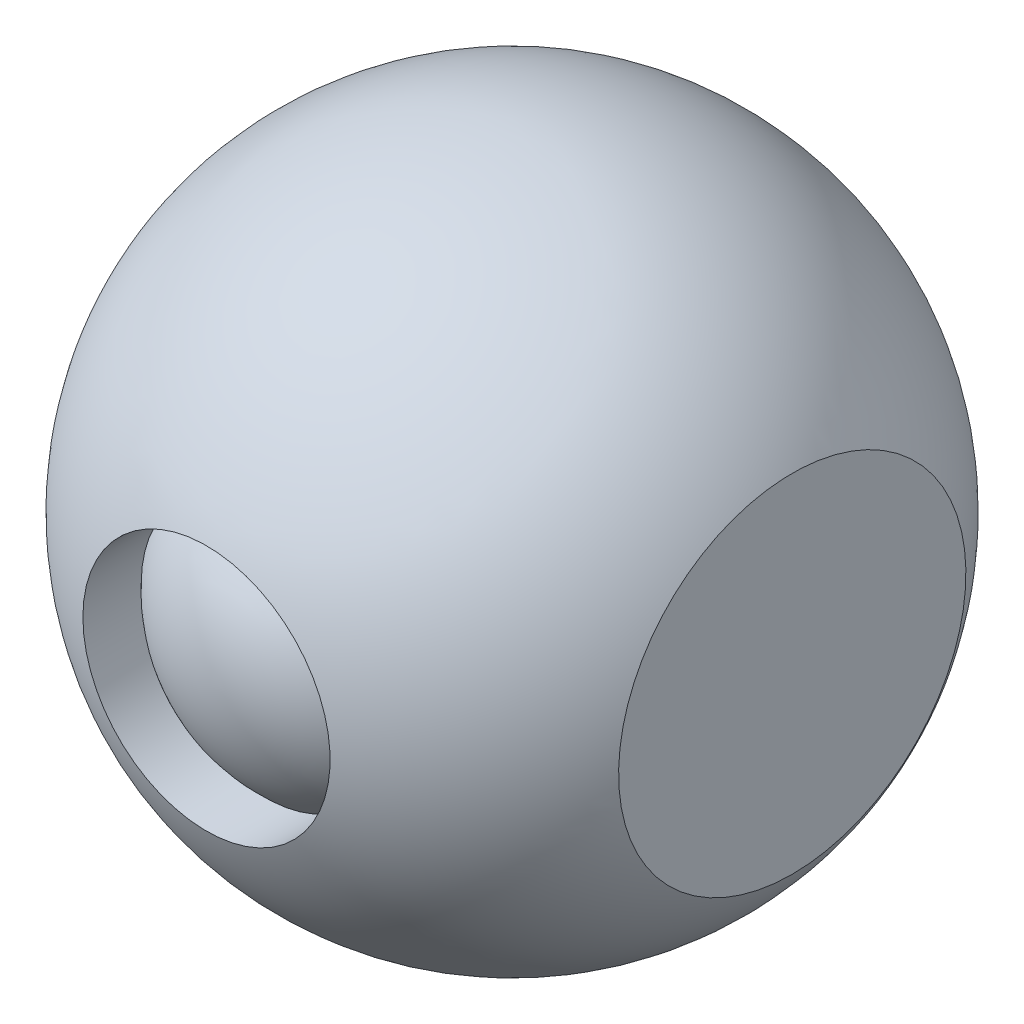
from build123d import *
from build123d.topology import SkipClean

# Parameters (mm, degrees)
CUT_EXTRUDE_1_REACH      = 101
CUT_EXTRUDE_1_END_RADIUS = 60
SKETCH_3_R               = 22.5
SKETCH_4_R               = 22.5
EXTRUDE_1_DEPTH          = 45
DOME_1_FACE_RADIUS       = 22.5
DOME_1_HEIGHT            = 10


with BuildPart() as part:
    # 草图1 → 旋转1 (revolve)
    with BuildSketch(Plane.XY):
        with BuildLine():
            Line((-51, 0), (51, 0))
            Line((51, 0), (51, 31.606961))
            ThreePointArc((51, 31.606961), (0, 60), (-51, 31.606961))
            Line((-51, 31.606961), (-51, 0))
        make_face()
    revolve(axis=Axis((-51, 0, 0), (1, 0, 0)))

    # 切除-拉伸1: up to this sphere (the profile starts inside it)
    with SkipClean():  # the faces are left unmerged after this step: merging them gives an invalid solid
        cut_extrude_1_end = Location((0, 0, 0)) * Sphere(CUT_EXTRUDE_1_END_RADIUS, mode=Mode.PRIVATE)
        # 草图3 → 切除-拉伸1 (cut, up to the surface)
        with BuildSketch(Plane.XY, mode=Mode.PRIVATE) as cut_extrude_1_sk1:
            with Locations(Location((0, 0, 0), (0, 0, 180))):
                Circle(SKETCH_3_R)
        cut_extrude_1_tool1 = extrude(cut_extrude_1_sk1.sketch, amount=CUT_EXTRUDE_1_REACH, mode=Mode.PRIVATE) & cut_extrude_1_end
        add(cut_extrude_1_tool1.solids().sort_by_distance((0, 0, 0))[0], mode=Mode.SUBTRACT)

    # 草图4 → 凸台-拉伸1 (add)
    with SkipClean():  # the faces are left unmerged after this step: merging them gives an invalid solid
        with BuildSketch(Plane.XY):
            with Locations(Location((0, 0, 0), (0, 0, 180))):
                Circle(SKETCH_4_R)
        extrude(amount=EXTRUDE_1_DEPTH)

    # 圆顶1: a dome of height H over a round flat face of radius A is a cap of a sphere of radius (A * A + H * H) / (2 * H)
    dome_1_r = (DOME_1_FACE_RADIUS * DOME_1_FACE_RADIUS + DOME_1_HEIGHT * DOME_1_HEIGHT) / (2 * DOME_1_HEIGHT)
    dome_1_base = Plane((0, 0, 45), z_dir=(0, 0, 1))
    with Locations(dome_1_base.offset(DOME_1_HEIGHT - dome_1_r)):
        dome_1_ball = Sphere(dome_1_r, mode=Mode.PRIVATE)
    add(split(dome_1_ball, bisect_by=dome_1_base, keep=Keep.TOP, mode=Mode.PRIVATE))


solid = part.part
